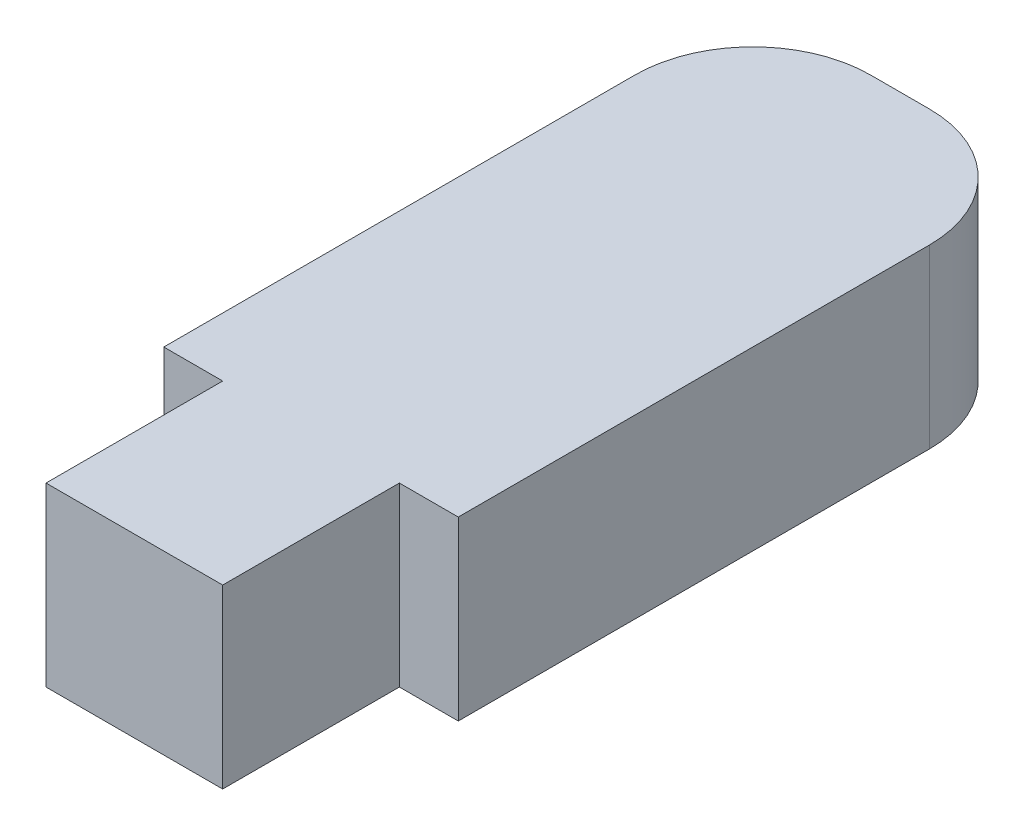
from build123d import *

# Parameters (mm, degrees)
BOSS_EXTRUDE1_DEPTH = 3


with BuildPart() as part:
    # Sketch1 → Boss-Extrude1 (new body)
    with BuildSketch(Plane(origin=(0, 0, 0), x_dir=(1, 0, 0), z_dir=(0, 1, 0))):
        with BuildLine():
            Line((-1, -3), (-4, -3))
            Line((-4, -3), (-4, 0))
            Line((-4, 0), (-5, 0))
            Line((-5, 0), (-5, 8))
            ThreePointArc((-5, 8), (-4.414213562, 9.414213562), (-3, 10))
            Line((-3, 10), (-2, 10))
            ThreePointArc((-2, 10), (-0.585786438, 9.414213562), (0, 8))
            Line((0, 8), (0, 0))
            Line((0, 0), (-1, 0))
            Line((-1, 0), (-1, -3))
        make_face()
    extrude(amount=BOSS_EXTRUDE1_DEPTH)


solid = part.part
